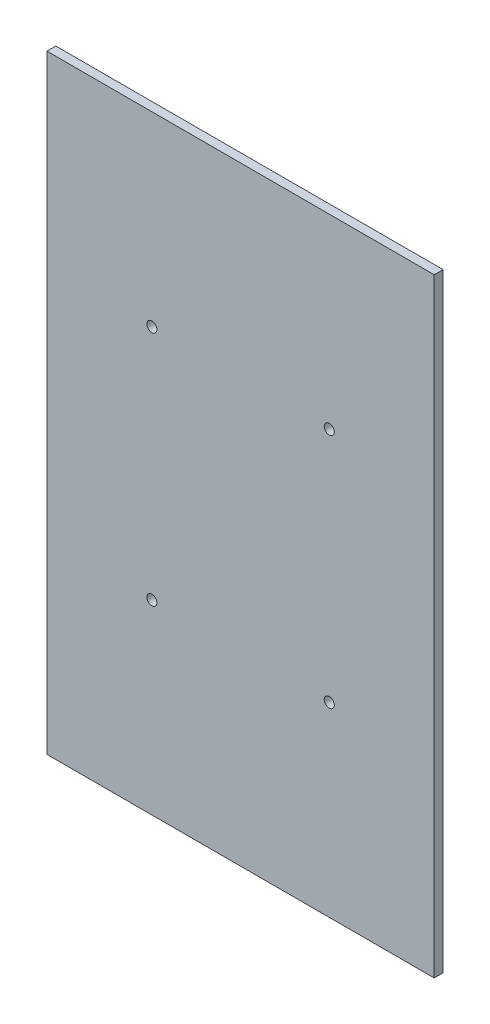
from build123d import *

# Parameters (mm, degrees)
SKETCH2_W           = 131
SKETCH2_H           = 206
BOSS_EXTRUDE1_DEPTH = 3
SKETCH3_R           = 1.7
CUT_EXTRUDE1_DEPTH  = 3


with BuildPart() as part:
    # Sketch2 → Boss-Extrude1 (new body)
    with BuildSketch(Plane.XY):
        Rectangle(SKETCH2_W, SKETCH2_H)
    extrude(amount=BOSS_EXTRUDE1_DEPTH)

    # Sketch3 → Cut-Extrude1 (cut)
    with BuildSketch(Plane(origin=(0, 0, 0), x_dir=(-1, 0, 0), z_dir=(0, 0, -1))):
        with Locations((-30, 40)):
            Circle(SKETCH3_R)
        with Locations(Location((-30, -40, 0), (0, 0, 180))):
            Circle(SKETCH3_R)
        with Locations((30, -40)):
            Circle(SKETCH3_R)
        with Locations(Location((30, 40, 0), (0, 0, 180))):
            Circle(SKETCH3_R)
    extrude(amount=-CUT_EXTRUDE1_DEPTH, mode=Mode.SUBTRACT)


solid = part.part
